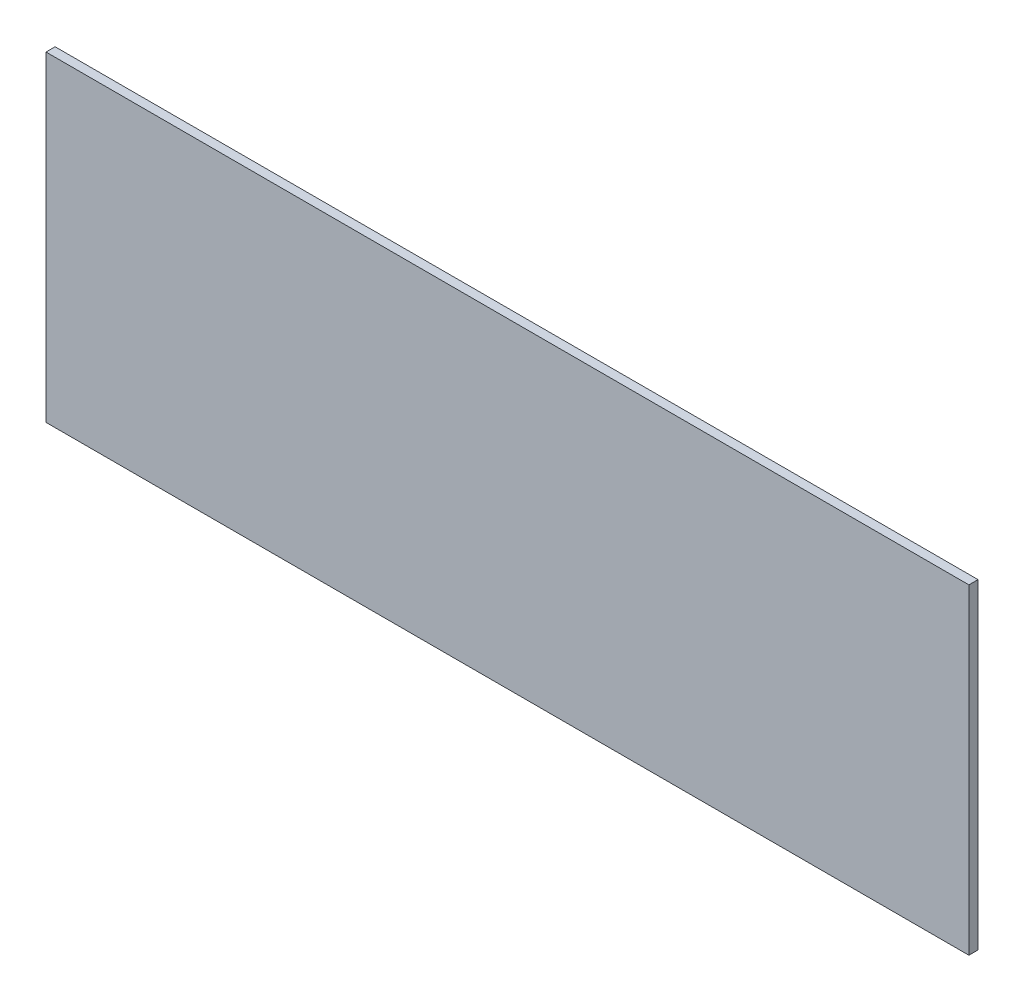
from build123d import *

# Parameters (mm, degrees)
SKETCH1_W           = 241.3
SKETCH1_H           = 83.8708
BOSS_EXTRUDE1_DEPTH = 2.38125


with BuildPart() as part:
    # Sketch1 → Boss-Extrude1 (new body)
    with BuildSketch(Plane.XY):
        Rectangle(SKETCH1_W, SKETCH1_H)
    extrude(amount=BOSS_EXTRUDE1_DEPTH)


solid = part.part
